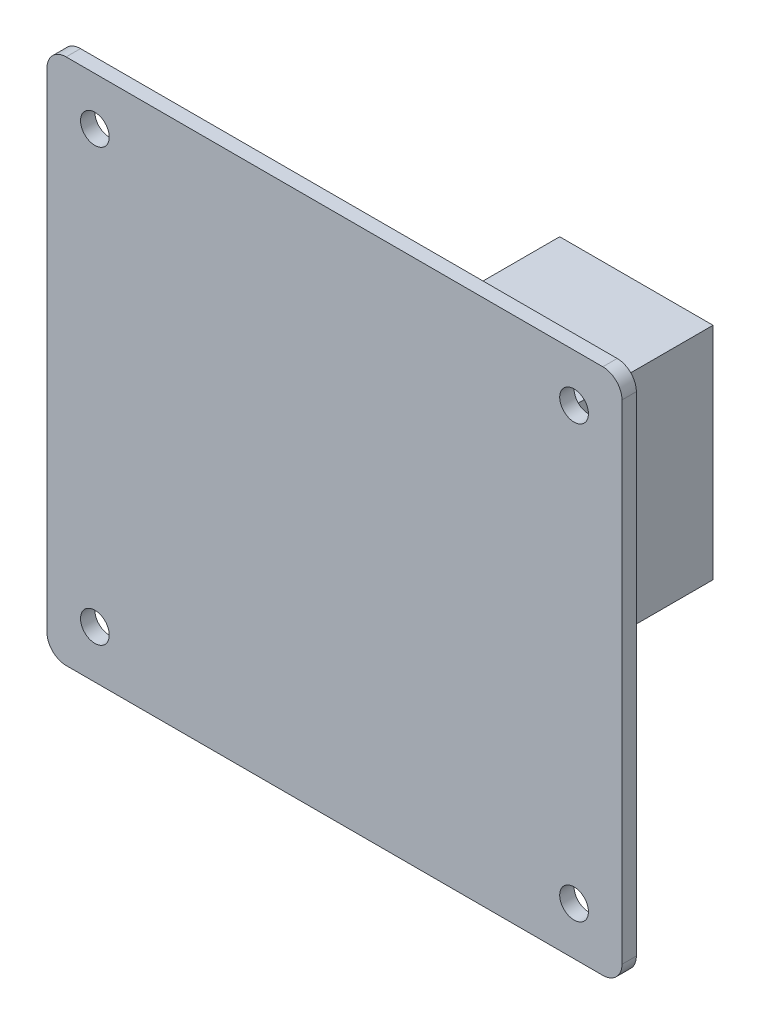
from build123d import *

# Parameters (mm, degrees)
ESQUISSE1_W             = 60
ESQUISSE1_H             = 55
BOSS_EXTRU_1_DEPTH      = 1.5
CONG_1_R                = 2
ESQUISSE2_R             = 1.5
ENL_V_MAT_EXTRU_1_DEPTH = 1.5
ESQUISSE3_W             = 16
ESQUISSE3_H             = 23
BOSS_EXTRU_2_DEPTH      = 25


with BuildPart() as part:
    # Esquisse1 → Boss.-Extru.1 (new body)
    with BuildSketch(Plane.XY):
        with Locations((30, 27.5)):
            Rectangle(ESQUISSE1_W, ESQUISSE1_H)
    extrude(amount=BOSS_EXTRU_1_DEPTH)

    # Congé1
    cong_1_edges = [part.edges().sort_by_distance(p)[0] for p in [
        (0, 55, 0.75),
        (60, 55, 0.75),
        (60, 0, 0.75),
        (0, 0, 0.75),
    ]]
    fillet(cong_1_edges, radius=CONG_1_R)

    # Esquisse2 → Enlèv. mat.-Extru.1 (cut)
    with BuildSketch(Plane(origin=(0, 0, 0), x_dir=(-1, 0, 0), z_dir=(0, 0, -1))):
        with Locations((-5, 5)):
            Circle(ESQUISSE2_R)
        with Locations((-5, 50)):
            Circle(ESQUISSE2_R)
        with Locations((-55, 50)):
            Circle(ESQUISSE2_R)
        with Locations((-55, 5)):
            Circle(ESQUISSE2_R)
    extrude(amount=-ENL_V_MAT_EXTRU_1_DEPTH, mode=Mode.SUBTRACT)

    # Esquisse3 → Boss.-Extru.2 (add)
    with BuildSketch(Plane(origin=(0, 0, 0), x_dir=(-1, 0, 0), z_dir=(0, 0, -1))):
        with Locations((-35, 26.5)):
            Rectangle(ESQUISSE3_W, ESQUISSE3_H)
    extrude(amount=BOSS_EXTRU_2_DEPTH)


solid = part.part
